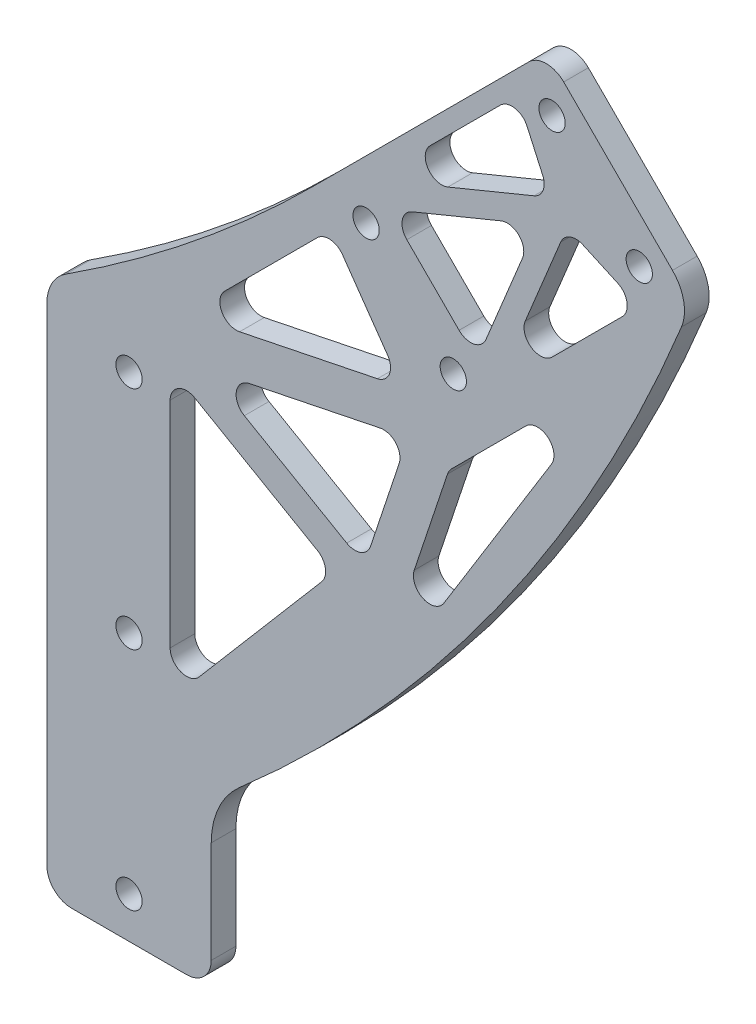
from build123d import *

# Parameters (mm, degrees)
SKETCH_1_W          = 20
SKETCH_1_H          = 65
EXTRUDE_1_DEPTH     = 3
SKETCH_2_R          = 1.6
CUT_EXTRUDE_1_DEPTH = 3
EXTRUDE_2_DEPTH     = 3
EXTRUDE_3_DEPTH     = 3
SKETCH_8_R          = 1.6
CUT_EXTRUDE_3_DEPTH = 143.659058168
FILLET_1_R          = 10
FILLET_2_R          = 3
FILLET_3_R          = 5
CUT_EXTRUDE_4_DEPTH = 142.149179722
FILLET_4_R          = 2


with BuildPart() as part:
    # 草图1 → 凸台-拉伸1 (new body)
    with BuildSketch(Plane.XY):
        with Locations((10, 32.5)):
            Rectangle(SKETCH_1_W, SKETCH_1_H)
    extrude(amount=EXTRUDE_1_DEPTH)

    # 草图2 → 切除-拉伸1 (cut)
    with BuildSketch(Plane.XY.offset(3)):
        with Locations((10, 60)):
            Circle(SKETCH_2_R)
        with Locations((10, 32.5)):
            Circle(SKETCH_2_R)
        with Locations((10, 5)):
            Circle(SKETCH_2_R)
    extrude(amount=-CUT_EXTRUDE_1_DEPTH, mode=Mode.SUBTRACT)



with BuildPart() as body_2:
    # 草图3 → 凸台-拉伸2 (new body)
    with BuildSketch(Plane.XY.offset(3)):
        Polygon((32.478445072, 90.836309448), (50.156114601, 73.158639918), (78.440385849, 101.442911166), (60.762716319, 119.120580695), align=None)
    extrude(amount=-EXTRUDE_2_DEPTH)


with BuildPart() as part_1:
    add(part.part)

    add(body_2.part)  # 凸台-拉伸3 merges body 2
    # 草图4 → 凸台-拉伸3 (add)
    with BuildSketch(Plane.XY.offset(3)):
        with BuildLine():
            Line((78.440385849, 101.442911166), (50.156114601, 73.158639918))
            Line((50.156114601, 73.158639918), (32.478445072, 90.836309448))
            ThreePointArc((32.478445072, 90.836309448), (16.972550072, 76.996299451), (0, 65))
            Line((0, 65), (20, 65))
            Line((20, 65), (20, 20))
            ThreePointArc((20, 20), (54.405363127, 57.00077145), (78.440385849, 101.442911166))
        make_face()
    extrude(amount=-EXTRUDE_3_DEPTH)

    # 草图8 → 切除-拉伸3 (cut, through all)
    with BuildSketch(Plane.XY.offset(3)):
        with Locations((61.4698231, 112.756619665)):
            Circle(SKETCH_8_R)
        with Locations((72.076424818, 102.150017947)):
            Circle(SKETCH_8_R)
        with Locations((49.44900782, 79.522600949)):
            Circle(SKETCH_8_R)
        with Locations((38.842406102, 90.129202667)):
            Circle(SKETCH_8_R)
    extrude(amount=-CUT_EXTRUDE_3_DEPTH, mode=Mode.SUBTRACT)

    # 圆角1
    fillet_1_edges = [part_1.edges().sort_by_distance(p)[0] for p in [
        (20, 20, 1.5),
    ]]
    fillet(fillet_1_edges, radius=FILLET_1_R)

    # 圆角2
    fillet_2_edges = [part_1.edges().sort_by_distance(p)[0] for p in [
        (60.762716319, 119.120580695, 1.5),
        (20, 0, 1.5),
        (0, 0, 1.5),
    ]]
    fillet(fillet_2_edges, radius=FILLET_2_R)

    # 圆角3
    fillet_3_edges = [part_1.edges().sort_by_distance(p)[0] for p in [
        (78.440385849, 101.442911166, 1.5),
        (0, 65, 1.5),
    ]]
    fillet(fillet_3_edges, radius=FILLET_3_R)

    # 草图10 → 切除-拉伸4 (cut, through all)
    with BuildSketch(Plane.XY.offset(3)):
        Polygon((16.922095886, 69.623106012), (34.599765415, 87.300775542), (43.20341196, 75.013494878), align=None)
        Polygon((19.465452368, 65.040672027), (43.955639167, 70.06369408), (38.60577187, 53.99000341), align=None)
        Polygon((15, 63), (35, 51.452994616), (15, 28), align=None)
        Polygon((39.549512883, 95.078950135), (57.227182413, 112.756619665), (61.186980388, 103.988495578), align=None)
        Polygon((41.670833227, 92.957629791), (59.702056147, 100.382250994), (52.277434945, 82.351028074), align=None)
        Polygon((63.308300731, 101.867175234), (54.398755288, 80.22970773), (72.076424818, 97.90737726), align=None)
        Polygon((48.893917057, 69.06801525), (39.281396308, 40.187170828), (70.417203629, 90.591301821), align=None)
    extrude(amount=-CUT_EXTRUDE_4_DEPTH, mode=Mode.SUBTRACT)

    # 圆角4
    fillet_4_edges = [part_1.edges().sort_by_distance(p)[0] for p in [
        (15, 28, 1.5),
        (15, 63, 1.5),
        (35, 51.452994616, 1.5),
        (38.60577187, 53.99000341, 1.5),
        (19.465452368, 65.040672027, 1.5),
        (43.955639167, 70.06369408, 1.5),
        (52.277434945, 82.351028074, 1.5),
        (41.670833227, 92.957629791, 1.5),
        (59.702056147, 100.382250994, 1.5),
        (61.186980388, 103.988495578, 1.5),
        (39.549512883, 95.078950135, 1.5),
        (57.227182413, 112.756619665, 1.5),
        (48.893917057, 69.06801525, 1.5),
        (70.417203629, 90.591301821, 1.5),
        (39.281396308, 40.187170828, 1.5),
        (63.308300731, 101.867175234, 1.5),
        (72.076424818, 97.90737726, 1.5),
        (54.398755288, 80.22970773, 1.5),
        (43.20341196, 75.013494878, 1.5),
        (16.922095886, 69.623106012, 1.5),
        (34.599765415, 87.300775542, 1.5),
    ]]
    fillet(fillet_4_edges, radius=FILLET_4_R)


solid = part_1.part
